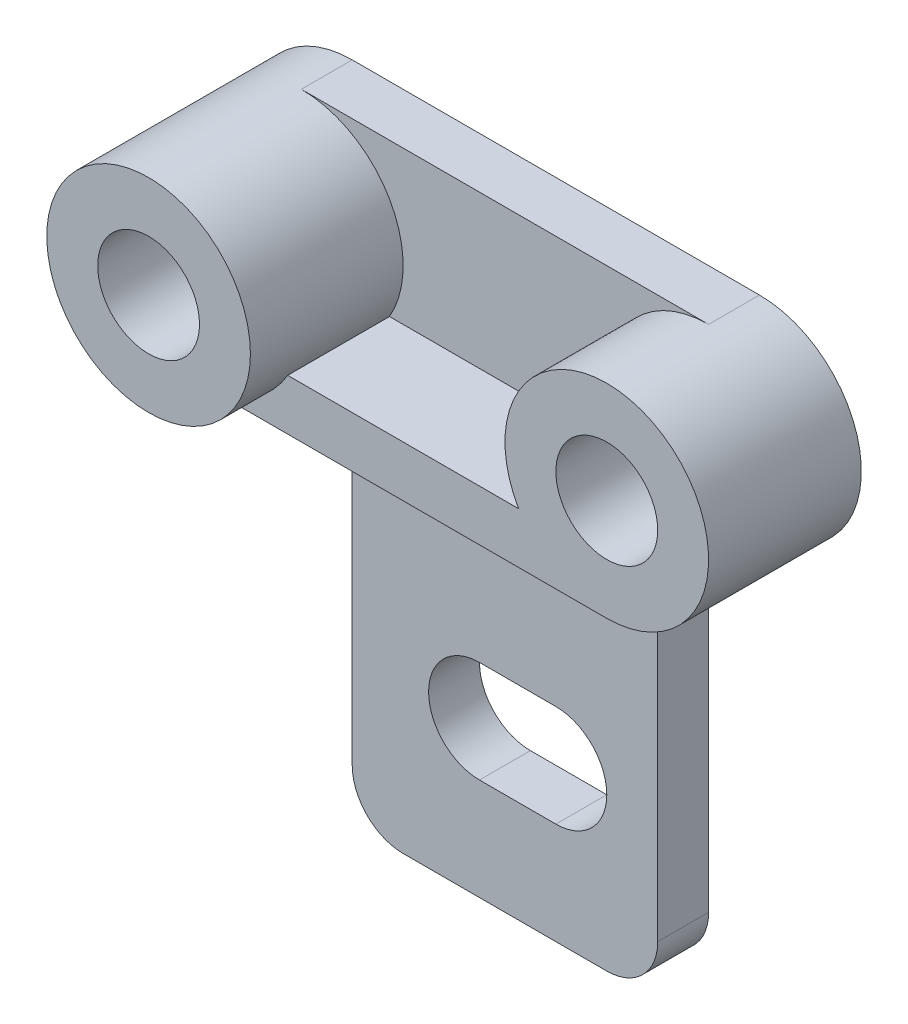
from build123d import *

# Parameters (mm, degrees)
SKETCH1_W           = 60
SKETCH1_H           = 80
BOSS_EXTRUDE1_DEPTH = 10
BOSS_EXTRUDE2_DEPTH = 10
SKETCH1_4_R         = 10
BOSS_EXTRUDE3_DEPTH = 30
SKETCH1_5_R         = 10
BOSS_EXTRUDE4_DEPTH = 40
FILLET1_R           = 10


with BuildPart() as part:
    # Sketch1 → Boss-Extrude1 (new body)
    with BuildSketch(Plane.XY):
        with Locations((0, 40)):
            Rectangle(SKETCH1_W, SKETCH1_H)
        with BuildLine():
            Line((-5, 40), (10, 40))
            ThreePointArc((10, 40), (20, 30), (10, 20))
            Line((10, 20), (-5, 20))
            ThreePointArc((-5, 20), (-15, 30), (-5, 40))
        make_face(mode=Mode.SUBTRACT)
    extrude(amount=BOSS_EXTRUDE1_DEPTH)



with BuildPart() as body_2:
    # Sketch1<3> → Boss-Extrude2 (new body)
    with BuildSketch(Plane.XY):
        with BuildLine():
            Line((40, 120), (-40, 120))
            ThreePointArc((-40, 120), (-25.857864376, 114.142135624), (-20, 100))
            ThreePointArc((-20, 100), (-20.681483474, 94.823619098), (-22.679491924, 90))
            Line((-22.679491924, 90), (22.679491924, 90))
            ThreePointArc((22.679491924, 90), (22.679491924, 110), (40, 120))
        make_face()
    extrude(amount=BOSS_EXTRUDE2_DEPTH)


with BuildPart() as part_1:
    add(part.part)

    add(body_2.part)  # Boss-Extrude3 merges body 2
    # Sketch1<4> → Boss-Extrude3 (add)
    with BuildSketch(Plane.XY):
        with BuildLine():
            Line((-40, 80), (40, 80))
            ThreePointArc((40, 80), (50, 117.320508076), (22.679491924, 90))
            Line((22.679491924, 90), (-22.679491924, 90))
            ThreePointArc((-22.679491924, 90), (-30, 82.679491924), (-40, 80))
        make_face()
        with Locations((40, 100)):
            Circle(SKETCH1_4_R, mode=Mode.SUBTRACT)
    extrude(amount=BOSS_EXTRUDE3_DEPTH)

    # Sketch1<5> → Boss-Extrude4 (add)
    with BuildSketch(Plane.XY):
        with BuildLine():
            ThreePointArc((-40, 120), (-60, 100), (-40, 80))
            ThreePointArc((-40, 80), (-30, 82.679491924), (-22.679491924, 90))
            ThreePointArc((-22.679491924, 90), (-20.681483474, 94.823619098), (-20, 100))
            ThreePointArc((-20, 100), (-25.857864376, 114.142135624), (-40, 120))
        make_face()
        with Locations((-40, 100)):
            Circle(SKETCH1_5_R, mode=Mode.SUBTRACT)
    extrude(amount=BOSS_EXTRUDE4_DEPTH)

    # Fillet1
    fillet1_edges = [part_1.edges().sort_by_distance(p)[0] for p in [
        (-30, 0, 5),
        (30, 0, 5),
    ]]
    fillet(fillet1_edges, radius=FILLET1_R)


solid = part_1.part
